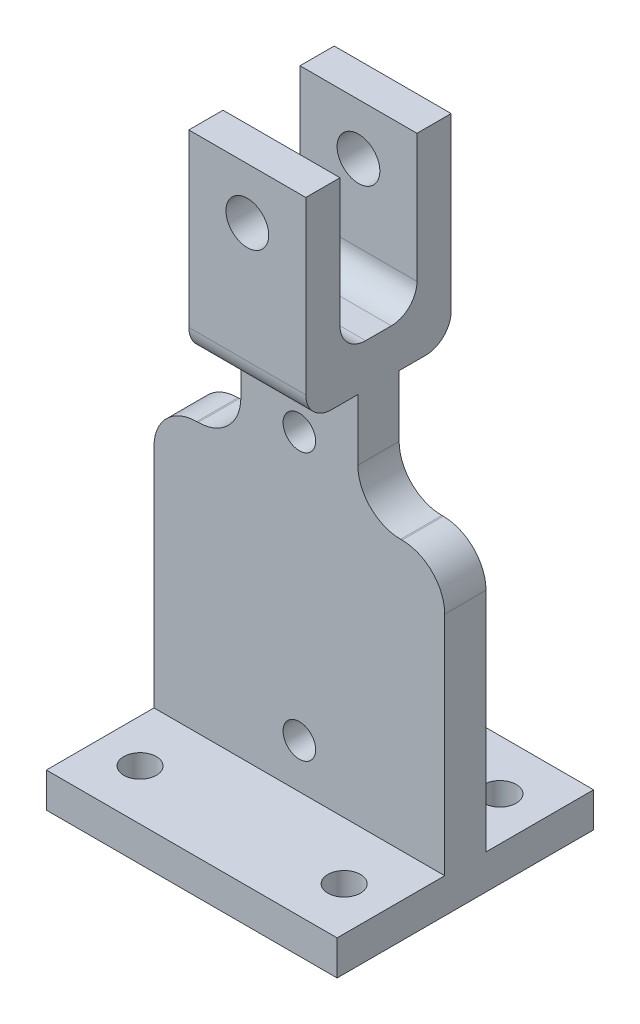
from build123d import *

# Parameters (mm, degrees)
SKETCH1_R           = 1.905
BOSS_EXTRUDE1_DEPTH = 2.413
SKETCH3_W           = 34
SKETCH3_H           = 30
SKETCH3_R           = 1.905
BOSS_EXTRUDE2_DEPTH = 4.064
FILLET1_R           = 5
SKETCH5_W           = 13.68
SKETCH5_H           = 4.826
SKETCH5_H_2         = 2.087
BOSS_EXTRUDE4_DEPTH = 5
SKETCH5_3_W         = 13.68
SKETCH5_3_H         = 4
BOSS_EXTRUDE5_DEPTH = 23
CUT_EXTRUDE1_REACH  = 74.693
SKETCH6_R           = 2.5
FILLET2_R           = 3


with BuildPart() as part:
    # Sketch1 → Boss-Extrude1 (new, symmetric)
    # profile 1 of 2: a face of its own
    with BuildSketch(Plane.XY):
        Polygon((-17, 31.496), (-17, 0), (17, 0), (17, 31.496), (6.84, 31.496), (6.84, 43.656), (-6.84, 43.656), (-6.84, 31.496), align=None)
        with Locations((0, 5.207)):
            Circle(SKETCH1_R, mode=Mode.SUBTRACT)
        with Locations((0, 36.449)):
            Circle(SKETCH1_R, mode=Mode.SUBTRACT)
    # profile 2 of 2: a face of its own
    with BuildSketch(Plane.XY):
        Polygon((-17, 31.496), (-17, 0), (17, 0), (17, 31.496), (6.84, 31.496), (6.84, 43.656), (-6.84, 43.656), (-6.84, 31.496), align=None)
        with Locations((0, 5.207)):
            Circle(SKETCH1_R, mode=Mode.SUBTRACT)
        with Locations((0, 36.449)):
            Circle(SKETCH1_R, mode=Mode.SUBTRACT)
    extrude(amount=BOSS_EXTRUDE1_DEPTH, both=True)

    # Sketch3 → Boss-Extrude2 (add)
    with BuildSketch(Plane(origin=(0, 0, 0), x_dir=(1, 0, 0), z_dir=(0, 1, 0))):
        Rectangle(SKETCH3_W, SKETCH3_H)
        with Locations(Location((-11.935, -9.11, 0), (0, 0, 270))):
            Circle(SKETCH3_R, mode=Mode.SUBTRACT)
        with Locations(Location((11.935, -9.11, 0), (0, 0, 270))):
            Circle(SKETCH3_R, mode=Mode.SUBTRACT)
        with Locations(Location((11.935, 9.11, 0), (0, 0, 270))):
            Circle(SKETCH3_R, mode=Mode.SUBTRACT)
        with Locations(Location((-11.935, 9.11, 0), (0, 0, 270))):
            Circle(SKETCH3_R, mode=Mode.SUBTRACT)
    extrude(amount=-BOSS_EXTRUDE2_DEPTH)

    # Fillet1
    fillet1_edges = [part.edges().sort_by_distance(p)[0] for p in [
        (6.84, 31.496, 0),
        (17, 31.496, 0),
        (-17, 31.496, 0),
        (-6.84, 31.496, 0),
    ]]
    fillet(fillet1_edges, radius=FILLET1_R)

    # Sketch5 → Boss-Extrude4 (add)
    with BuildSketch(Plane(origin=(0, 43.656, 0), x_dir=(1, 0, 0), z_dir=(0, 1, 0))):
        Rectangle(SKETCH5_W, SKETCH5_H)
        with Locations((0, -3.4565)):
            Rectangle(SKETCH5_W, SKETCH5_H_2)
        with Locations((0, 3.4565)):
            Rectangle(SKETCH5_W, SKETCH5_H_2)
    extrude(amount=BOSS_EXTRUDE4_DEPTH)

    # Sketch5<3> → Boss-Extrude5 (add)
    with BuildSketch(Plane(origin=(0, 43.656, 0), x_dir=(1, 0, 0), z_dir=(0, 1, 0))):
        with Locations((0, -6.5)):
            Rectangle(SKETCH5_3_W, SKETCH5_3_H)
        with Locations((0, 6.5)):
            Rectangle(SKETCH5_3_W, SKETCH5_3_H)
    extrude(amount=BOSS_EXTRUDE5_DEPTH)

    # Cut-Extrude1: up to this face of the body (flat: up to its plane)
    cut_extrude1_end = Plane(part.part.faces().sort_by_distance((0, 55.156, 8.5))[0])
    # Sketch6 → Cut-Extrude1 (cut, up to the picked face)
    with BuildSketch(Plane(origin=(0, 0, -8.5), x_dir=(-1, 0, 0), z_dir=(0, 0, -1)), mode=Mode.PRIVATE) as cut_extrude1_sk1:
        with Locations((0, 60.656)):
            Circle(SKETCH6_R)
    cut_extrude1_tool1 = split(extrude(cut_extrude1_sk1.sketch, amount=-CUT_EXTRUDE1_REACH, mode=Mode.PRIVATE), bisect_by=cut_extrude1_end, keep=Keep.BOTH, mode=Mode.PRIVATE)
    add(cut_extrude1_tool1.solids().sort_by(Axis((0, 60.656, -8.5), (0, 0, 1)))[0], mode=Mode.SUBTRACT)

    # Fillet2
    fillet2_edges = [part.edges().sort_by_distance(p)[0] for p in [
        (0, 43.656, -8.5),
        (0, 48.656, -4.5),
        (0, 48.656, 4.5),
        (0, 43.656, 8.5),
    ]]
    fillet(fillet2_edges, radius=FILLET2_R)


solid = part.part
